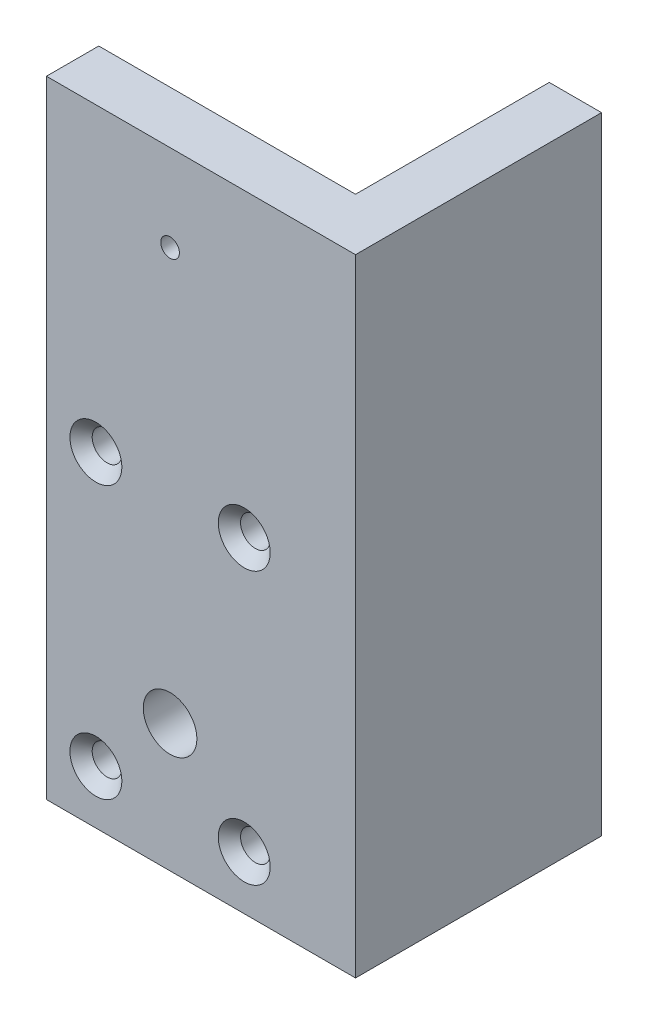
from build123d import *

# Parameters (mm, degrees)
SKETCH1_W                                       = 37.5
SKETCH1_H                                       = 46
SKETCH1_R                                       = 6.25
SKETCH1_R_2                                     = 3.5
SKETCH1_R_3                                     = 3.25
SKETCH1_R_4                                     = 1.7
BOSS_EXTRUDE1_DEPTH                             = 6.35
CSK_FOR_M3_FLAT_HEAD_MACHINE_SCREW1_D           = 3.6
CSK_FOR_M3_FLAT_HEAD_MACHINE_SCREW1_CSINK_D     = 6.3
CSK_FOR_M3_FLAT_HEAD_MACHINE_SCREW1_CSINK_ANGLE = 90
SKETCH3_W                                       = 6.35
SKETCH3_H                                       = 46
BOSS_EXTRUDE2_DEPTH                             = 23.5
BOSS_EXTRUDE4_DEPTH                             = 30
CUT_EXTRUDE1_REACH                              = 91.851
SKETCH6_R                                       = 1.1303
SKETCH7_R                                       = 1.3890625
CUT_EXTRUDE2_DEPTH                              = 10


with BuildPart() as part:
    # Sketch1 → Boss-Extrude1 (new body)
    # profile 1 of 6: a face of its own
    with BuildSketch(Plane.XY):
        with Locations((18.75, 23)):
            Rectangle(SKETCH1_W, SKETCH1_H)
        with Locations((15, 15.5)):
            Circle(SKETCH1_R, mode=Mode.SUBTRACT)
        with Locations((24, 6.5)):
            Circle(SKETCH1_R_2, mode=Mode.SUBTRACT)
        with Locations((6, 6.5)):
            Circle(SKETCH1_R_2, mode=Mode.SUBTRACT)
        with Locations((6, 39.5)):
            Circle(SKETCH1_R_2, mode=Mode.SUBTRACT)
        with Locations((24, 39.5)):
            Circle(SKETCH1_R_2, mode=Mode.SUBTRACT)
    # profile 2 of 6: a face of its own
    with BuildSketch(Plane.XY):
        with Locations((15, 15.5)):
            Circle(SKETCH1_R)
        with Locations((15, 15.5)):
            Circle(SKETCH1_R_3, mode=Mode.SUBTRACT)
    # profile 3 of 6: a face of its own
    with BuildSketch(Plane.XY):
        with Locations((6, 39.5)):
            Circle(SKETCH1_R_2)
        with Locations((6, 39.5)):
            Circle(SKETCH1_R_4, mode=Mode.SUBTRACT)
    # profile 4 of 6: a face of its own
    with BuildSketch(Plane.XY):
        with Locations((24, 39.5)):
            Circle(SKETCH1_R_2)
        with Locations((24, 39.5)):
            Circle(SKETCH1_R_4, mode=Mode.SUBTRACT)
    # profile 5 of 6: a face of its own
    with BuildSketch(Plane.XY):
        with Locations((24, 6.5)):
            Circle(SKETCH1_R_2)
        with Locations((24, 6.5)):
            Circle(SKETCH1_R_4, mode=Mode.SUBTRACT)
    # profile 6 of 6: a face of its own
    with BuildSketch(Plane.XY):
        with Locations((6, 6.5)):
            Circle(SKETCH1_R_2)
        with Locations((6, 6.5)):
            Circle(SKETCH1_R_4, mode=Mode.SUBTRACT)
    extrude(amount=BOSS_EXTRUDE1_DEPTH)

    # CSK for M3 Flat Head Machine Screw1 (through all)
    with Locations(Plane(origin=(6, 6.5, 6.35), x_dir=(1, 0, 0), z_dir=(0, 0, 1))):
        with Locations((0, 0), (0, 33), (18, 33), (18, 0)):
            CounterSinkHole(CSK_FOR_M3_FLAT_HEAD_MACHINE_SCREW1_D / 2, CSK_FOR_M3_FLAT_HEAD_MACHINE_SCREW1_CSINK_D / 2, counter_sink_angle=CSK_FOR_M3_FLAT_HEAD_MACHINE_SCREW1_CSINK_ANGLE)

    # Sketch3 → Boss-Extrude2 (add)
    with BuildSketch(Plane(origin=(0, 0, 0), x_dir=(-1, 0, 0), z_dir=(0, 0, -1))):
        with Locations((-34.325, 23)):
            Rectangle(SKETCH3_W, SKETCH3_H)
    extrude(amount=BOSS_EXTRUDE2_DEPTH)

    # Sketch5 → Boss-Extrude4 (add)
    with BuildSketch(Plane(origin=(0, 46, 0), x_dir=(1, 0, 0), z_dir=(0, 1, 0))):
        Polygon((31.15, 0), (0, 0), (0, -6.35), (37.5, -6.35), (37.5, 23.5), (31.15, 23.5), align=None)
    extrude(amount=BOSS_EXTRUDE4_DEPTH)

    # Sketch6 → Cut-Extrude1 (cut, up to next)
    with BuildSketch(Plane.XY.offset(6.35), mode=Mode.PRIVATE) as cut_extrude1_sk1:
        with Locations((15, 65.5)):
            Circle(SKETCH6_R)
    cut_extrude1_tool1 = extrude(cut_extrude1_sk1.sketch, amount=-CUT_EXTRUDE1_REACH, mode=Mode.PRIVATE) & part.part
    add(cut_extrude1_tool1.solids().sort_by_distance((15, 65.5, 6.35))[0], mode=Mode.SUBTRACT)

    # Sketch7 → Cut-Extrude2 (cut)
    with BuildSketch(Plane(origin=(0, 0, -23.5), x_dir=(-1, 0, 0), z_dir=(0, 0, -1))):
        with Locations((-34.325, 10)):
            Circle(SKETCH7_R)
        with Locations((-34.325, 66)):
            Circle(SKETCH7_R)
    extrude(amount=-CUT_EXTRUDE2_DEPTH, mode=Mode.SUBTRACT)


solid = part.part
